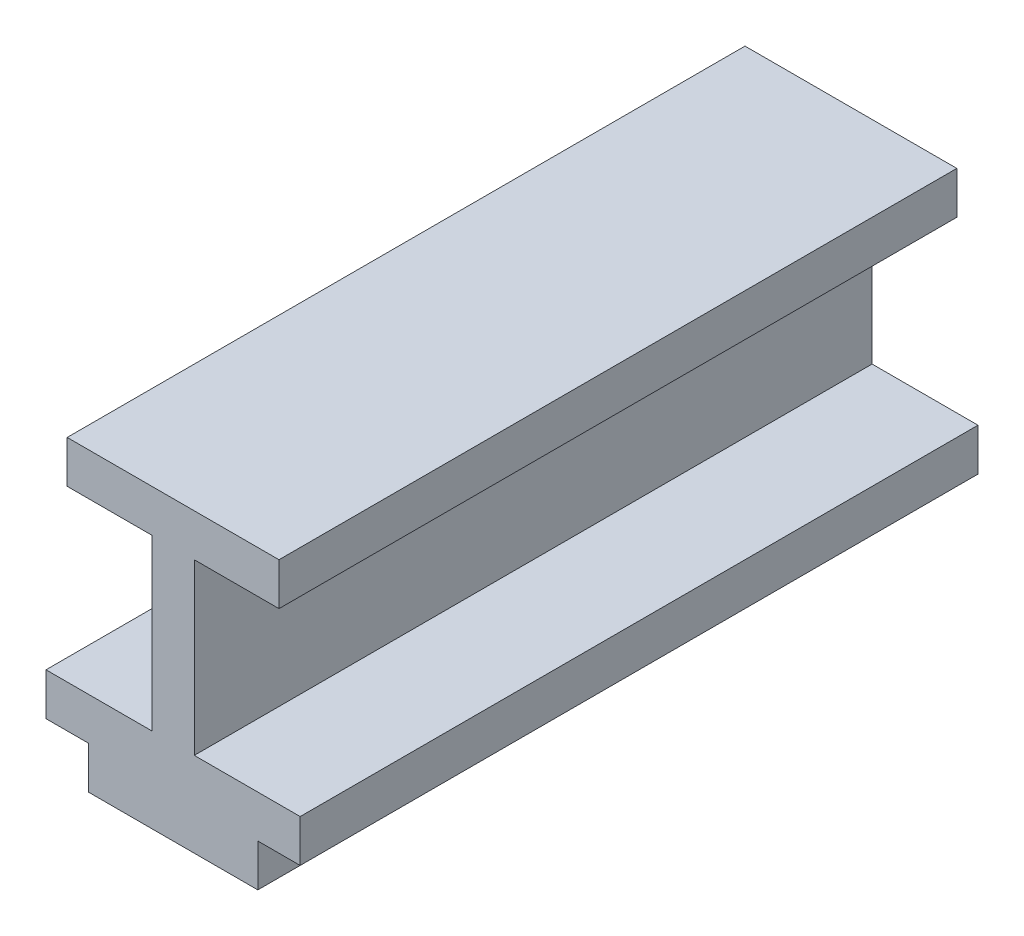
from build123d import *

# Parameters (mm, degrees)
EXTRUDE_1_DEPTH = 160


with BuildPart() as part:
    # Эскиз1 → Бобышка-Вытянуть1 (new body)
    with BuildSketch(Plane.XY):
        Polygon((-5, 20), (-5, -20), (-30, -20), (-30, -30), (-20, -30), (-20, -40), (20, -40), (20, -30), (30, -30), (30, -20), (5, -20), (5, 20), (25, 20), (25, 30), (-25, 30), (-25, 20), align=None)
    extrude(amount=EXTRUDE_1_DEPTH)


solid = part.part
